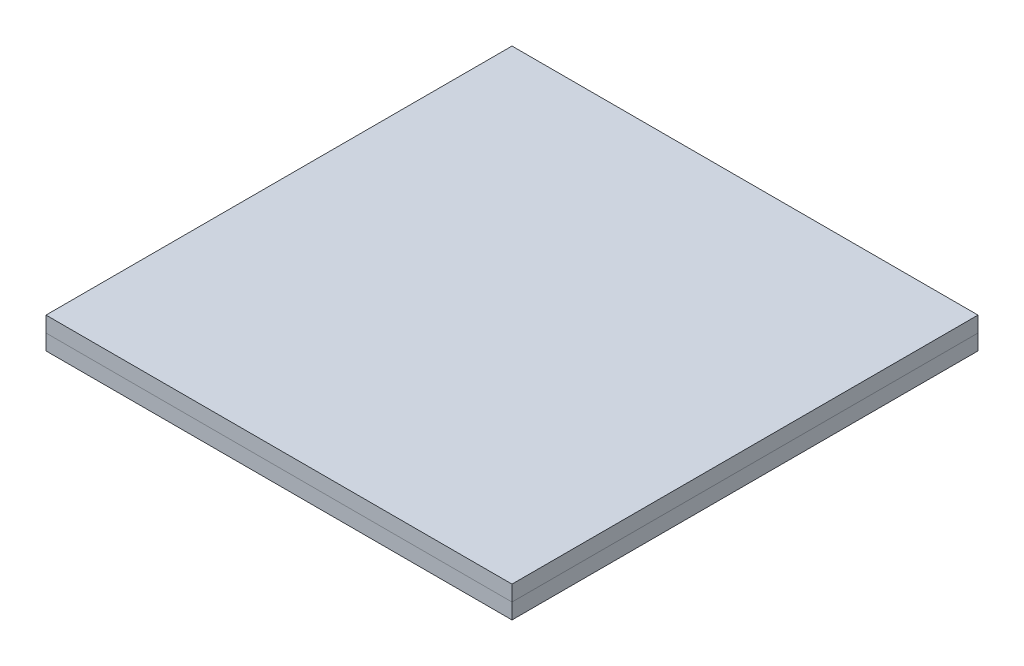
from build123d import *

# Parameters (mm, degrees)
SKETCH1_W           = 38.1
SKETCH1_H           = 38.1
BOSS_EXTRUDE1_DEPTH = 2.54


with BuildPart() as part:
    # Sketch1 → Boss-Extrude1 (new body)
    with BuildSketch(Plane(origin=(0, 0, 0), x_dir=(1, 0, 0), z_dir=(0, 1, 0))):
        Rectangle(SKETCH1_W, SKETCH1_H)
    extrude(amount=BOSS_EXTRUDE1_DEPTH)


with BuildPart() as body_2:
    # Split1: the piece on the far side of the plane
    add(part.part)
    split(bisect_by=Plane(origin=(0, 1.27, 0), x_dir=(0, 0, -1), z_dir=(0, -1, 0)), keep=Keep.BOTTOM)


with BuildPart() as part_1:
    add(part.part)

    # Split1
    split(bisect_by=Plane(origin=(0, 1.27, 0), x_dir=(0, 0, -1), z_dir=(0, -1, 0)), keep=Keep.TOP)


solid = Compound([body_2.part, part_1.part])
